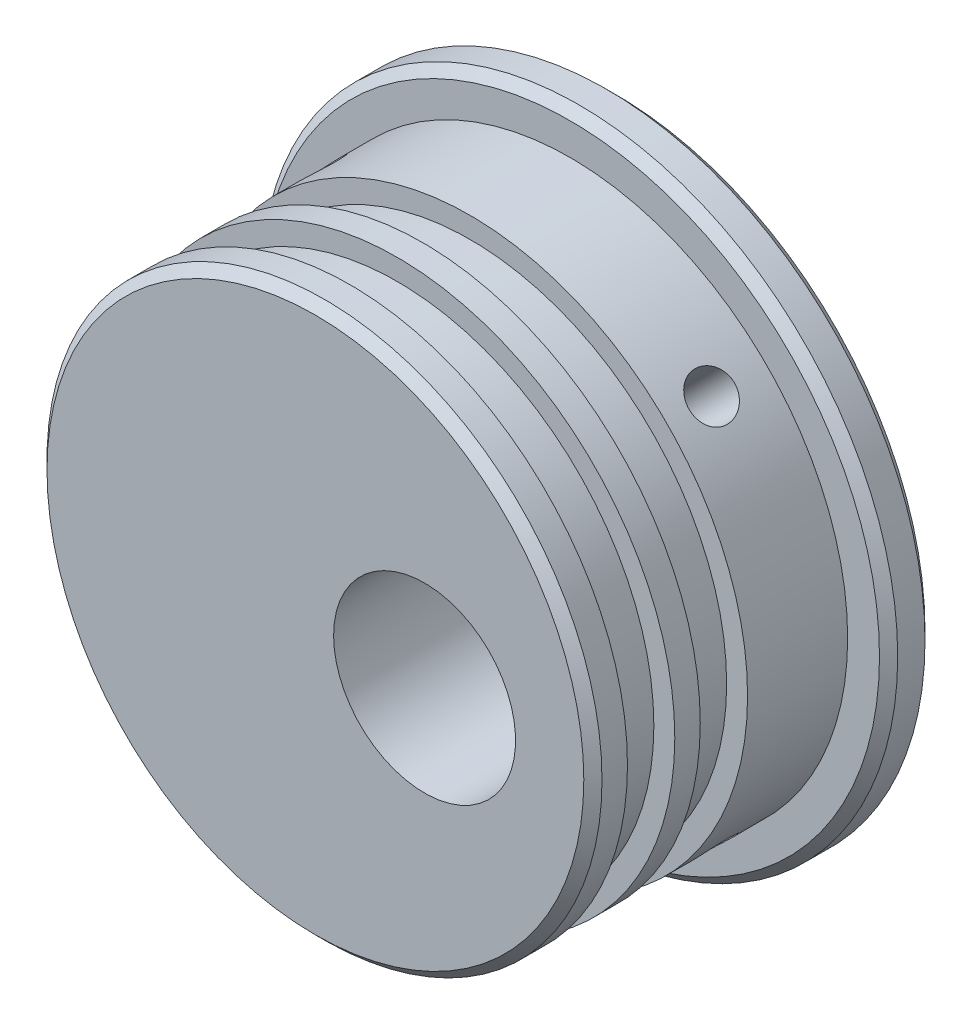
from build123d import *

# Parameters (mm, degrees)
SKETCH_1_R               = 17.5
EXTRUDE_1_DEPTH          = 2.5
SKETCH_1_3_R             = 15.25
EXTRUDE_2_DEPTH          = 14
CUT_EXTRUDE_START        = 5.5
SKETCH_1_4_R             = 15.25
SKETCH_1_4_R_2           = 14.1
CUT_EXTRUDE_1_DEPTH      = 2.6
CUT_EXTRUDE_START_2      = 9.5
SKETCH_1_5_R             = 15.25
SKETCH_1_5_R_2           = 14.1
CUT_EXTRUDE_2_DEPTH      = 2.6
CHAMFER_1_SIZE           = 0.5
SKETCH_2_R               = 5
CUT_EXTRUDE_5_DEPTH      = 30.744747435
CUT_EXTRUDE_START_3      = 10
SKETCH_4_R               = 1.25
CUT_EXTRUDE_6_DEPTH      = 19.434134416
PATTERN_CIRCULAR_1_COUNT = 4


with BuildPart() as part:
    # Эскиз1 → Бобышка-Вытянуть1 (new body)
    with BuildSketch(Plane.XY):
        Circle(SKETCH_1_R)
    extrude(amount=-EXTRUDE_1_DEPTH)

    # Эскиз1<3> → Бобышка-Вытянуть2 (add)
    with BuildSketch(Plane.XY):
        Circle(SKETCH_1_3_R)
    extrude(amount=EXTRUDE_2_DEPTH)

    # Эскиз1<4> → Вырез-Вытянуть1 (cut)
    with BuildSketch(Plane.XY.offset(CUT_EXTRUDE_START)):
        Circle(SKETCH_1_4_R)
        Circle(SKETCH_1_4_R_2, mode=Mode.SUBTRACT)
    extrude(amount=CUT_EXTRUDE_1_DEPTH, mode=Mode.SUBTRACT)

    # Эскиз1<5> → Вырез-Вытянуть2 (cut)
    with BuildSketch(Plane.XY.offset(CUT_EXTRUDE_START_2)):
        Circle(SKETCH_1_5_R)
        Circle(SKETCH_1_5_R_2, mode=Mode.SUBTRACT)
    extrude(amount=CUT_EXTRUDE_2_DEPTH, mode=Mode.SUBTRACT)

    # Фаска1
    chamfer_1_edges = [part.edges().sort_by_distance(p)[0] for p in [
        (-15.25, 0, 14),
        (-17.5, 0, 0),
        (-17.5, 0, -2.5),
    ]]
    chamfer(chamfer_1_edges, length=CHAMFER_1_SIZE)

    # Эскиз2 → Вырез-Вытянуть5 (cut, through all)
    with BuildSketch(Plane(origin=(0, 0, -2.5), x_dir=(-1, 0, 0), z_dir=(0, 0, -1))):
        with Locations((-6, 0)):
            Circle(SKETCH_2_R)
    extrude(amount=-CUT_EXTRUDE_5_DEPTH, mode=Mode.SUBTRACT)

    # Эскиз4 → Вырез-Вытянуть6 (cut, through all)
    with BuildSketch(Plane(origin=(0, 0, 0), x_dir=(0, 0, -1), z_dir=(0.7071067811865488, 0.7071067811865464, 0)).offset(CUT_EXTRUDE_START_3)):
        with Locations((-3, 0)):
            Circle(SKETCH_4_R)
    cut_extrude_6 = extrude(amount=CUT_EXTRUDE_6_DEPTH, mode=Mode.SUBTRACT)

    # Круговой массив1: Вырез-Вытянуть6 ×4 about axis
    pattern_circular_1_axis = Axis((0, 0, 0), (0, 0, -1))
    for i in range(1, PATTERN_CIRCULAR_1_COUNT):
        add(cut_extrude_6.rotate(pattern_circular_1_axis, i * 360 / PATTERN_CIRCULAR_1_COUNT), mode=Mode.SUBTRACT)


solid = part.part
